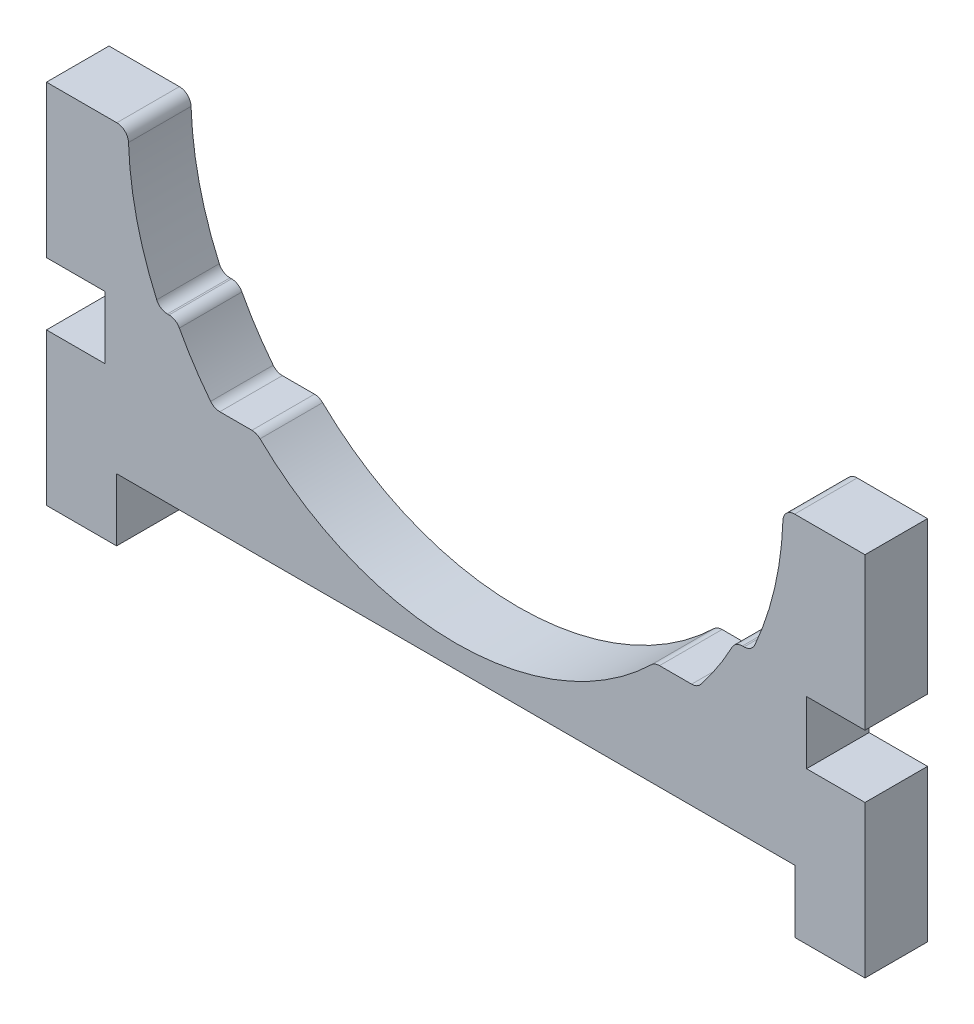
from build123d import *

# Parameters (mm, degrees)
BOSS_EXTRUDE1_DEPTH = 5.35


with BuildPart() as part:
    # Model → Boss-Extrude1 (new body)
    with BuildSketch(Plane.XY):
        with BuildLine():
            Line((10.342343988, 19.35), (10.483423975, 19.35))
            ThreePointArc((10.483423975, 19.35), (10.998948723, 19.20687469), (11.366904192, 18.818468468))
            ThreePointArc((11.366904192, 18.818468468), (12.610215159, 16.712376055), (14.040684229, 14.728640777))
            ThreePointArc((14.040684229, 14.728640777), (14.389100425, 14.449622517), (14.824210053, 14.35))
            Line((14.824210053, 14.35), (17.571488159, 14.35))
            ThreePointArc((17.571488159, 14.35), (17.946708443, 14.276935671), (18.26709829, 14.068419477))
            ThreePointArc((18.26709829, 14.068419477), (35, 7.295), (51.73290171, 14.068419477))
            ThreePointArc((51.73290171, 14.068419477), (52.053291557, 14.276935671), (52.428511841, 14.35))
            Line((52.428511841, 14.35), (55.175789947, 14.35))
            ThreePointArc((55.175789947, 14.35), (55.610899575, 14.449622517), (55.959315771, 14.728640777))
            ThreePointArc((55.959315771, 14.728640777), (57.389784841, 16.712376055), (58.633095808, 18.818468468))
            ThreePointArc((58.633095808, 18.818468468), (59.001051277, 19.20687469), (59.516576025, 19.35))
            Line((59.516576025, 19.35), (59.657656012, 19.35))
            ThreePointArc((59.657656012, 19.35), (60.201987066, 19.511129507), (60.570902531, 19.942592593))
            ThreePointArc((60.570902531, 19.942592593), (62.28136196, 25.047041201), (62.9833482, 30.384482759))
            ThreePointArc((62.9833482, 30.384482759), (63.287945159, 31.069194952), (63.982753492, 31.35))
            Line((63.982753492, 31.35), (70, 31.35))
            Line((70, 31.35), (70, 18.35))
            Line((70, 18.35), (65, 18.35))
            Line((65, 18.35), (65, 13))
            Line((65, 13), (70, 13))
            Line((70, 13), (70, 0))
            Line((70, 0), (64, 0))
            Line((64, 0), (64, 5.35))
            Line((64, 5.35), (6, 5.35))
            Line((6, 5.35), (6, 0))
            Line((6, 0), (0, 0))
            Line((0, 0), (0, 13))
            Line((0, 13), (5, 13))
            Line((5, 13), (5, 18.35))
            Line((5, 18.35), (0, 18.35))
            Line((0, 18.35), (0, 31.35))
            Line((0, 31.35), (6.017246508, 31.35))
            ThreePointArc((6.017246508, 31.35), (6.712054841, 31.069194952), (7.0166518, 30.384482759))
            ThreePointArc((7.0166518, 30.384482759), (7.71863804, 25.047041201), (9.429097469, 19.942592593))
            ThreePointArc((9.429097469, 19.942592593), (9.798012934, 19.511129507), (10.342343988, 19.35))
        make_face()
    extrude(amount=BOSS_EXTRUDE1_DEPTH)


solid = part.part
